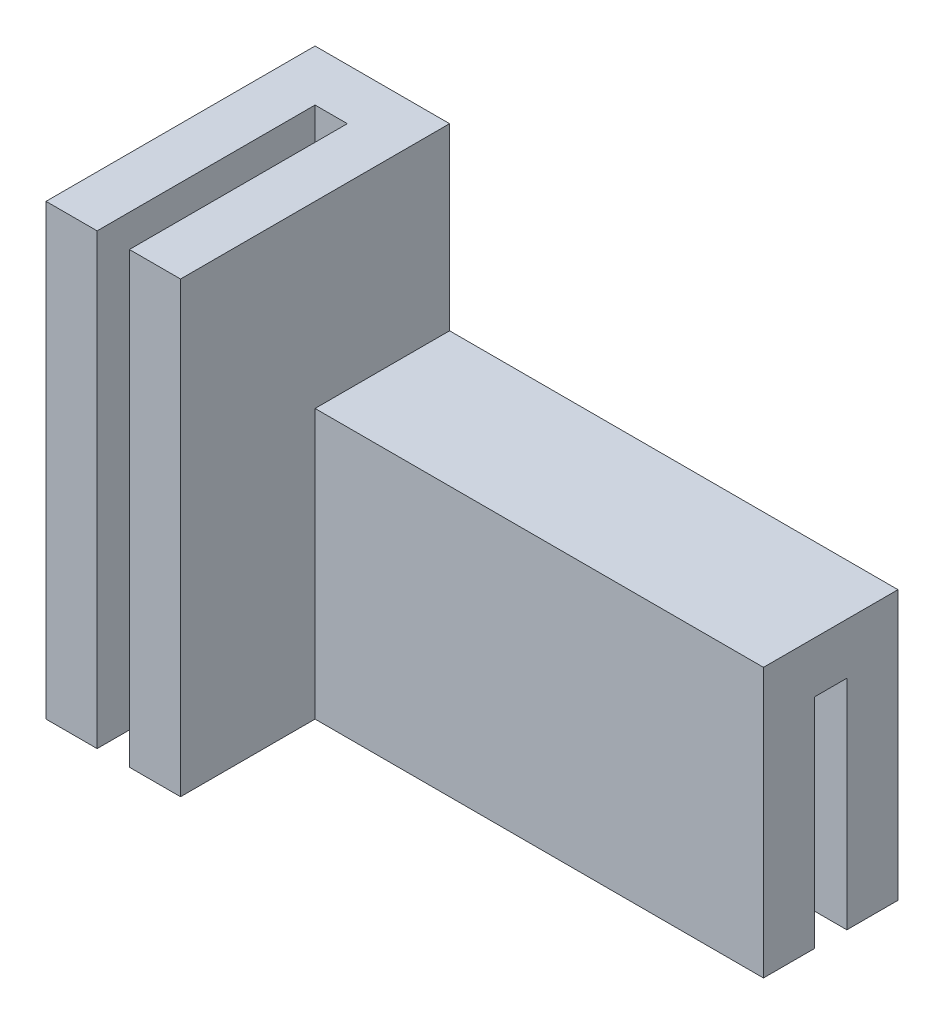
from build123d import *

# Parameters (mm, degrees)
ESQUISSE1_W             = 15
ESQUISSE1_H             = 50
BOSS_EXTRU_1_DEPTH      = 30
ESQUISSE2_W             = 3.6
ESQUISSE2_H             = 50
ENL_V_MAT_EXTRU_1_DEPTH = 24.3
BOSS_EXTRU_2_DEPTH      = 50
ESQUISSE5_W             = 3.6
ESQUISSE5_H             = 24.3
ENL_V_MAT_EXTRU_2_DEPTH = 2


with BuildPart() as part:
    # Esquisse1 → Boss.-Extru.1 (new body)
    with BuildSketch(Plane.XY):
        with Locations((7.5, -25)):
            Rectangle(ESQUISSE1_W, ESQUISSE1_H)
    extrude(amount=BOSS_EXTRU_1_DEPTH)

    # Esquisse2 → Enlèv. mat.-Extru.1 (cut)
    with BuildSketch(Plane.XY.offset(30)):
        with Locations((7.5, -25)):
            Rectangle(ESQUISSE2_W, ESQUISSE2_H)
    extrude(amount=-ENL_V_MAT_EXTRU_1_DEPTH, mode=Mode.SUBTRACT)

    # Esquisse4 → Boss.-Extru.2 (add)
    with BuildSketch(Plane(origin=(15, 0, 0), x_dir=(0, 0, -1), z_dir=(1, 0, 0))):
        Polygon((0, -50), (0, -20), (-15, -20), (-15, -50), (-9.3, -50), (-9.3, -25.7), (-5.7, -25.7), (-5.7, -50), align=None)
    extrude(amount=BOSS_EXTRU_2_DEPTH)

    # Esquisse5 → Enlèv. mat.-Extru.2 (cut)
    with BuildSketch(Plane(origin=(15, 0, 0), x_dir=(0, 0, -1), z_dir=(1, 0, 0))):
        with Locations((-7.5, -37.85)):
            Rectangle(ESQUISSE5_W, ESQUISSE5_H)
    extrude(amount=-ENL_V_MAT_EXTRU_2_DEPTH, mode=Mode.SUBTRACT)


solid = part.part
